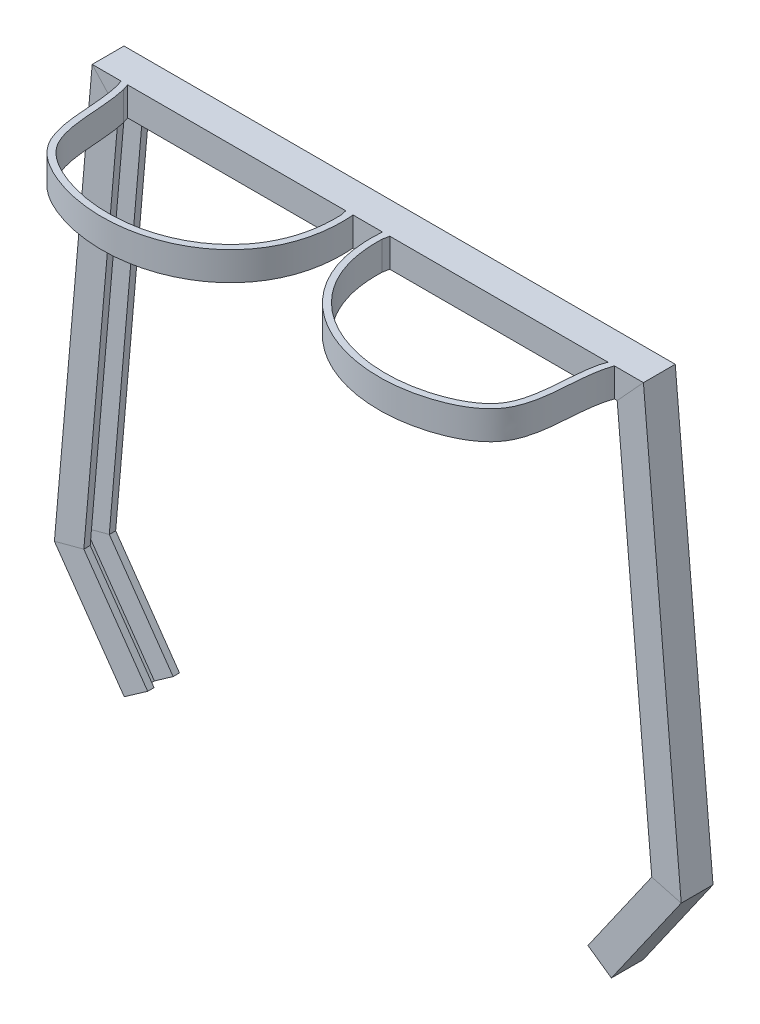
from build123d import *

# Parameters (mm, degrees)
FRAME_DEPTH              = 9
CUT_EXTRUDE_1_DEPTH      = 77.5
CUT_EXTRUDE_1_DEPTH_BACK = 77.5
SKETCH_8_W               = 6
SKETCH_8_H               = 7.2


with BuildPart() as part:
    # 草图1 → frame (new body)
    with BuildSketch(Plane(origin=(0, 0, 0), x_dir=(1, 0, 0), z_dir=(0, 1, 0))):
        with BuildLine():
            Line((77.5, 21.66163142), (-77.5, 21.66163142))
            Line((-77.5, 21.66163142), (-77.5, 11.66163142))
            add(Edge.make_bspline(
                [(-77.5, 11.66163142), (-74.407700798, 3.186863233), (-78.13080327, -15.927288699), (-40.25886312, -37.426028597), (-2.116282918, -20.689046368), (-4.622356495, 11.66163142)],
                knots=[0, 0, 0, 0, 0.2461215, 0.369792099, 1, 1, 1, 1], degree=3))
            Line((-4.622356495, 11.66163142), (4.622356495, 11.66163142))
            add(Edge.make_bspline(
                [(77.5, 11.66163142), (74.407700798, 3.186863233), (78.13080327, -15.927288699), (40.25886312, -37.426028597), (2.116282918, -20.689046368), (4.622356495, 11.66163142)],
                knots=[0, 0, 0, 0, 0.2461215, 0.369792099, 1, 1, 1, 1], degree=3))
            Line((77.5, 11.66163142), (77.5, 21.66163142))
        make_face()
        with BuildLine():
            Line((6.907388487, 11.66163142), (75.498489426, 11.66163142))
            Line((75.498489426, 11.66163142), (74.826320569, 9.66163142))
            add(Edge.make_bspline(
                [(74.826320569, 9.66163142), (74.537129512, 8.440205397), (74.118616889, 5.97852646), (73.621822389, 0.86906895), (73.254603503, -5.556962308), (72.241025744, -11.370637322), (70.601393479, -15.207799235), (68.270143007, -18.43048657), (63.731478169, -21.762919869), (56.85425746, -24.533410045), (49.722568077, -26.119696622), (40.058249914, -26.656581209), (30.63607695, -24.877975202), (22.314225365, -20.908251341), (16.828859323, -16.874650673), (12.291217041, -11.816635216), (9.449850549, -6.759991518), (7.834253455, -2.202532167), (6.977086921, 1.473147324), (6.581231794, 4.759863142), (6.469661343, 7.510165764), (6.485645336, 8.950311376), (6.511310136, 9.66163142)],
                knots=[0.022831488, 0.022831488, 0.022831488, 0.022831488, 0.052972273, 0.083113058, 0.143394628, 0.203676198, 0.233816983, 0.263957769, 0.324239339, 0.384520909, 0.444802479, 0.505084049, 0.625647189, 0.685928759, 0.746210329, 0.806491899, 0.866773469, 0.896914254, 0.92705504, 0.957195825, 0.972266217, 0.98733661, 0.98733661, 0.98733661, 0.98733661], degree=3))
            Line((6.511310136, 9.66163142), (6.907388487, 11.66163142))
        make_face(mode=Mode.SUBTRACT)
        with BuildLine():
            Line((-75.498489426, 11.66163142), (-6.907388487, 11.66163142))
            Line((-6.907388487, 11.66163142), (-6.511310136, 9.66163142))
            add(Edge.make_bspline(
                [(-74.826320569, 9.66163142), (-74.537129512, 8.440205397), (-74.118616889, 5.97852646), (-73.621822389, 0.86906895), (-73.254603503, -5.556962308), (-72.241025744, -11.370637322), (-70.601393479, -15.207799235), (-68.270143007, -18.43048657), (-63.731478169, -21.762919869), (-56.85425746, -24.533410045), (-49.722568077, -26.119696622), (-40.058249914, -26.656581209), (-30.63607695, -24.877975202), (-22.314225365, -20.908251341), (-16.828859323, -16.874650673), (-12.291217041, -11.816635216), (-9.449850549, -6.759991518), (-7.834253455, -2.202532167), (-6.977086921, 1.473147324), (-6.581231794, 4.759863142), (-6.469661343, 7.510165764), (-6.485645336, 8.950311376), (-6.511310136, 9.66163142)],
                knots=[0.022831488, 0.022831488, 0.022831488, 0.022831488, 0.052972273, 0.083113058, 0.143394628, 0.203676198, 0.233816983, 0.263957769, 0.324239339, 0.384520909, 0.444802479, 0.505084049, 0.625647189, 0.685928759, 0.746210329, 0.806491899, 0.866773469, 0.896914254, 0.92705504, 0.957195825, 0.972266217, 0.98733661, 0.98733661, 0.98733661, 0.98733661], degree=3))
            Line((-74.826320569, 9.66163142), (-75.498489426, 11.66163142))
        make_face(mode=Mode.SUBTRACT)
    extrude(amount=FRAME_DEPTH)

    # 扫描1: sweep along a path in 草图5
    with BuildLine(Plane(origin=(0, 0, -16.66163142), x_dir=(-1, 0, 0), z_dir=(0, 0, -1))) as sweep_1_path:
        Line((-77.5, 4.5), (-82.5, 4.5))
        Line((-82.5, 4.5), (-93.873526258, -125.5))
        Line((-93.873526258, -125.5), (-72.867300112, -155.5))
    # 草图4 → 扫描1 (sweep)
    with BuildSketch(Plane(origin=(77.5, 0, 0), x_dir=(0, 0, -1), z_dir=(1, 0, 0))):
        Polygon((11.66163142, 9), (11.66163142, 0), (13.66163142, 0), (13.66163142, 7.2), (19.66163142, 7.2), (19.66163142, 0), (21.66163142, 0), (21.66163142, 9), align=None)
    sweep(path=sweep_1_path.line, transition=Transition.RIGHT)

    # 扫描2: sweep along a path in 草图6
    with BuildLine(Plane(origin=(0, 0, -16.66163142), x_dir=(-1, 0, 0), z_dir=(0, 0, -1))) as sweep_2_path:
        Line((77.5, 4.5), (82.5, 4.5))
        Line((82.5, 4.5), (93.873526258, -125.5))
        Line((93.873526258, -125.5), (72.867300112, -155.5))
    # 草图7 → 扫描2 (sweep)
    with BuildSketch(Plane.ZY.offset(77.5)):
        Polygon((-21.66163142, 9), (-21.66163142, 0), (-19.66163142, 0), (-19.66163142, 7.2), (-13.66163142, 7.2), (-13.66163142, 0), (-11.66163142, 0), (-11.66163142, 9), align=None)
    sweep(path=sweep_2_path.line, transition=Transition.RIGHT)

    # 草图8 → 切除-拉伸1 (cut, two sides: drawn at the far end of the back side and taken through both)
    with BuildSketch(Plane(origin=(0, 0, 0), x_dir=(0, 0, -1), z_dir=(1, 0, 0)).offset(-CUT_EXTRUDE_1_DEPTH_BACK)):
        with Locations((16.66163142, 3.6)):
            Rectangle(SKETCH_8_W, SKETCH_8_H)
    extrude(amount=CUT_EXTRUDE_1_DEPTH + CUT_EXTRUDE_1_DEPTH_BACK, mode=Mode.SUBTRACT)


solid = part.part
